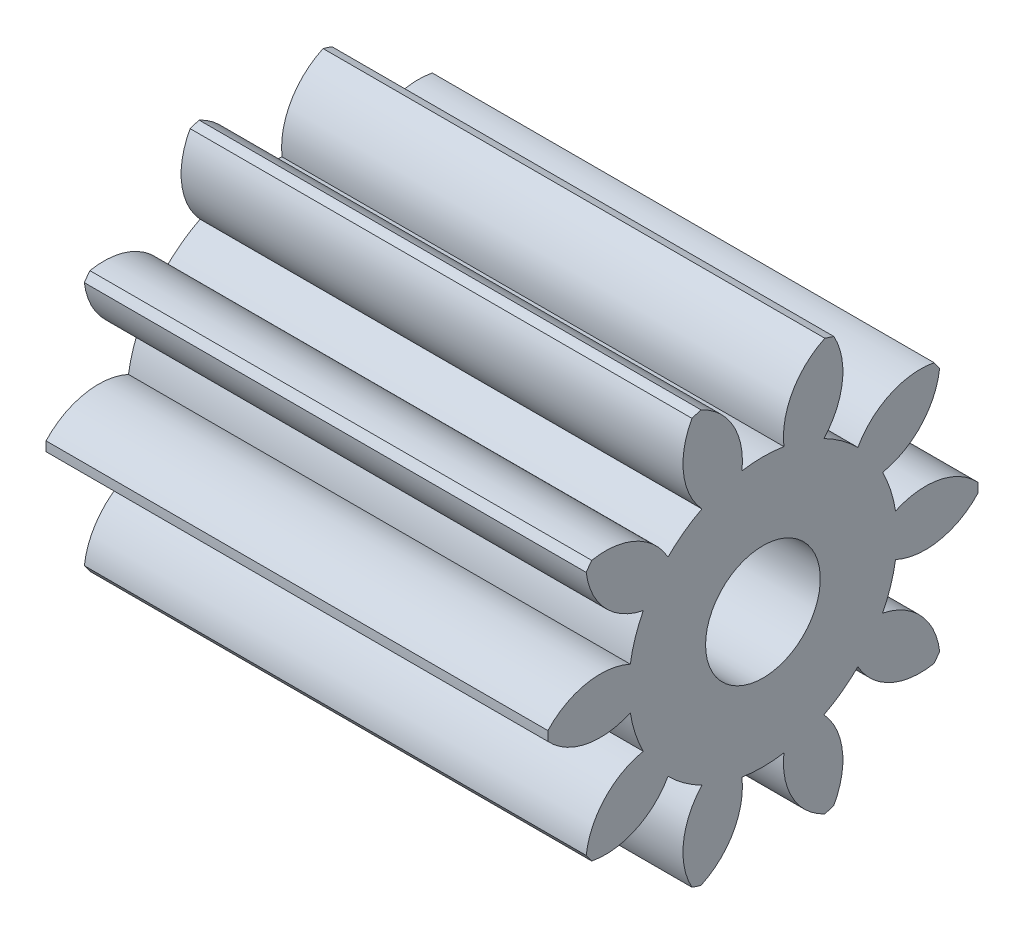
from build123d import *

# Parameters (mm, degrees)
BASPROSKE_W     = 3.5
BASPROSKE_H     = 1.5
TOOTHCUT_DEPTH  = 5.092676386
TEETHCUTS_COUNT = 10
TEETHCUTS_ANGLE = 324
BORSKE_R        = 0.4
BORE_DEPTH      = 50.0000508


with BuildPart() as part:
    # BasProSke → Base-Revolve (revolve)
    with BuildSketch(Plane(origin=(0, 0, 0), x_dir=(1, 0, 0), z_dir=(0, 1, 0)), mode=Mode.PRIVATE) as base_revolve_sk:
        with Locations((1.75, 0.75)):
            Rectangle(BASPROSKE_W, BASPROSKE_H)
    revolve(base_revolve_sk.sketch.rotate(Axis((-10, 0, 0), (1, 0, 0)), 180), axis=Axis((-10, 0, 0), (1, 0, 0)))

    # TooCutSke → ToothCut (cut, through all)
    with BuildSketch(Plane(origin=(0, 0, 0), x_dir=(0, 0, -1), z_dir=(1, 0, 0))):
        with BuildLine():
            ThreePointArc((0.146321185, 0.924998573), (0, 0.9365), (-0.146321185, 0.924998573))
            ThreePointArc((-0.146321185, 0.924998573), (-0.216454601, 1.244005636), (-0.468585949, 1.451644712))
            ThreePointArc((-0.468585949, 1.451644712), (0, 1.5254), (0.468585949, 1.451644712))
            ThreePointArc((0.468585949, 1.451644712), (0.216454601, 1.244005636), (0.146321185, 0.924998573))
        make_face()
    toothcut = extrude(amount=TOOTHCUT_DEPTH, mode=Mode.SUBTRACT)

    # TeethCuts: ToothCut ×10 about axis
    teethcuts_axis = Axis((-10, 0, 0), (1, 0, 0))
    for i in range(1, TEETHCUTS_COUNT):
        add(toothcut.rotate(teethcuts_axis, i * TEETHCUTS_ANGLE / (TEETHCUTS_COUNT - 1)), mode=Mode.SUBTRACT)

    # BorSke → Bore (cut, symmetric)
    with BuildSketch(Plane(origin=(0, 0, 0), x_dir=(0, 0, -1), z_dir=(1, 0, 0))):
        with Locations(Location((0, 0, 0), (0, 0, 180))):
            Circle(BORSKE_R)
    extrude(amount=BORE_DEPTH, both=True, mode=Mode.SUBTRACT)


solid = part.part
